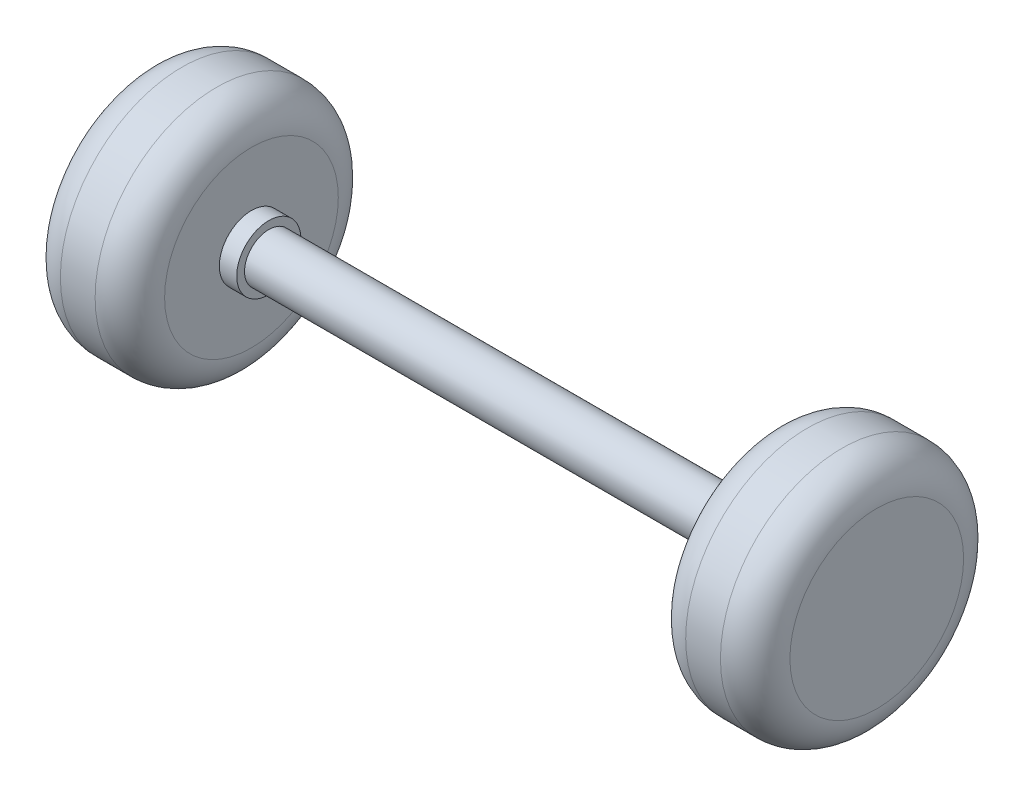
from build123d import *

# Parameters (mm, degrees)
SKETCH1_R               = 17.78
BOSS_EXTRUDE1_DEPTH     = 177.8
SKETCH9_R               = 23.495
BOSS_EXTRUDE4_DEPTH     = 12.7
MIRROR6_COPY_1_SKETCH_R = 23.495
MIRROR6_COPY_1_DEPTH    = 12.7
MIRROR6_COPY_2_SKETCH_R = 23.495
MIRROR6_COPY_2_DEPTH    = 12.7
MIRROR7_COPY_1_SKETCH_R = 23.495
MIRROR7_COPY_1_DEPTH    = 12.7
MIRROR7_COPY_2_SKETCH_R = 23.495
MIRROR7_COPY_2_DEPTH    = 12.7
MIRROR7_COPY_3_SKETCH_R = 23.495
MIRROR7_COPY_3_DEPTH    = 12.7
SKETCH13_R              = 88.9
BOSS_EXTRUDE6_DEPTH     = 76.2
FILLET3_R               = 25.4
FILLET4_R               = 25.4
FILLET3_OF_MIRROR11_R   = 25.4
FILLET4_OF_MIRROR11_R   = 25.4


with BuildPart() as part:
    # Sketch1 → Boss-Extrude1 (new, symmetric)
    with BuildSketch(Plane(origin=(0, 0, 0), x_dir=(0, 0, -1), z_dir=(1, 0, 0))):
        Circle(SKETCH1_R)
    extrude(amount=BOSS_EXTRUDE1_DEPTH, both=True)

    # Sketch9 → Boss-Extrude4 (add)
    with BuildSketch(Plane(origin=(177.8, 0, 0), x_dir=(0, 0, -1), z_dir=(1, 0, 0))):
        Circle(SKETCH9_R)
    boss_extrude4 = extrude(amount=BOSS_EXTRUDE4_DEPTH)

    # Mirror5: Boss-Extrude4 across plane
    add(boss_extrude4.mirror(Plane(origin=(0, 0, 0), x_dir=(0, 0, 1), z_dir=(1, 0, 0))))

    # Mirror6 copy 1 sketch → Mirror6 copy 1 (add)
    with BuildSketch(Plane.ZY.offset(177.8)):
        Circle(MIRROR6_COPY_1_SKETCH_R)
    extrude(amount=MIRROR6_COPY_1_DEPTH)

    # Mirror6 copy 2 sketch → Mirror6 copy 2 (add)
    with BuildSketch(Plane(origin=(177.8, 0, 0), x_dir=(0, 0, 1), z_dir=(1, 0, 0))):
        Circle(MIRROR6_COPY_2_SKETCH_R)
    extrude(amount=MIRROR6_COPY_2_DEPTH)

    # Mirror7 copy 1 sketch → Mirror7 copy 1 (add)
    with BuildSketch(Plane(origin=(-177.8, 0, 0), x_dir=(0, 0, -1), z_dir=(-1, 0, 0))):
        Circle(MIRROR7_COPY_1_SKETCH_R)
    extrude(amount=MIRROR7_COPY_1_DEPTH)

    # Mirror7 copy 2 sketch → Mirror7 copy 2 (add)
    with BuildSketch(Plane(origin=(177.8, 0, 0), x_dir=(0, 0, -1), z_dir=(1, 0, 0))):
        Circle(MIRROR7_COPY_2_SKETCH_R)
    extrude(amount=MIRROR7_COPY_2_DEPTH)

    # Mirror7 copy 3 sketch → Mirror7 copy 3 (add)
    with BuildSketch(Plane(origin=(177.8, 0, 0), x_dir=(0, 0, 1), z_dir=(1, 0, 0))):
        Circle(MIRROR7_COPY_3_SKETCH_R)
    extrude(amount=MIRROR7_COPY_3_DEPTH)

    # Sketch13 → Boss-Extrude6 (add)
    with BuildSketch(Plane(origin=(190.5, 0, 0), x_dir=(0, 0, -1), z_dir=(1, 0, 0))):
        with Locations(Location((0, 0, 0), (0, 0, 180))):
            Circle(SKETCH13_R)
    boss_extrude6 = extrude(amount=BOSS_EXTRUDE6_DEPTH)

    # Fillet3
    fillet3_edges = [part.edges().sort_by_distance(p)[0] for p in [
        (266.7, 0, -88.9),
    ]]
    fillet(fillet3_edges, radius=FILLET3_R)

    # Fillet4
    fillet4_edges = [part.edges().sort_by_distance(p)[0] for p in [
        (190.5, 0, -88.9),
    ]]
    fillet(fillet4_edges, radius=FILLET4_R)

    # Mirror11: Boss-Extrude6 across plane
    add(boss_extrude6.mirror(Plane(origin=(0, 0, 0), x_dir=(0, 0, 1), z_dir=(1, 0, 0))))

    # Fillet3 of Mirror11
    fillet3_of_mirror11_edges = [part.edges().sort_by_distance(p)[0] for p in [
        (-266.7, 0, -88.9),
    ]]
    fillet(fillet3_of_mirror11_edges, radius=FILLET3_OF_MIRROR11_R)

    # Fillet4 of Mirror11
    fillet4_of_mirror11_edges = [part.edges().sort_by_distance(p)[0] for p in [
        (-190.5, 0, -88.9),
    ]]
    fillet(fillet4_of_mirror11_edges, radius=FILLET4_OF_MIRROR11_R)


solid = part.part
